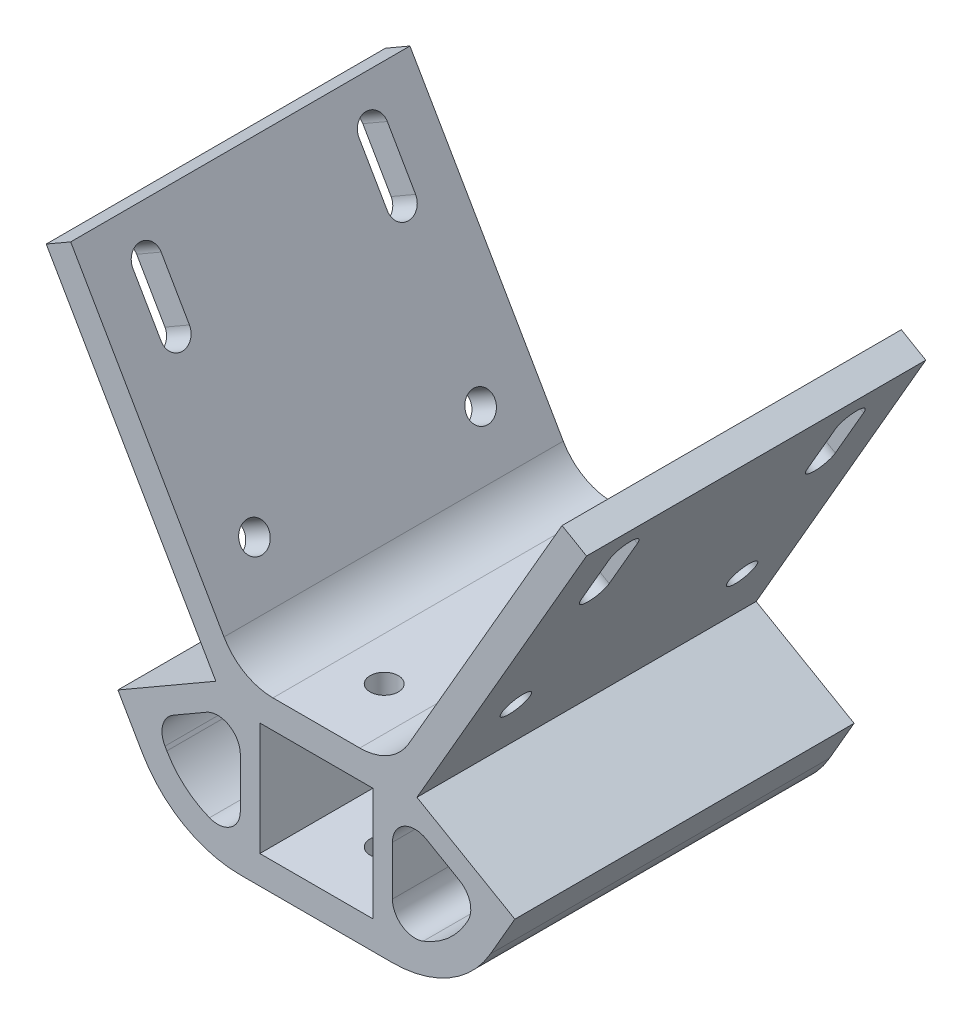
from build123d import *

# Parameters (mm, degrees)
SCHIZZO1_W                   = 20
SCHIZZO1_H                   = 20
ESTRUSIONE_ESTRUSIONE1_DEPTH = 60
RACCORDO1_R                  = 20
SCHIZZO8_R                   = 2.5
TAGLIO_ESTRUSIONE3_DEPTH     = 5
TAGLIO_ESTRUSIONE4_DEPTH     = 113.253811369
RACCORDO2_R                  = 10
RACCORDO3_R                  = 4
SCHIZZO11_R                  = 2.5
TAGLIO_ESTRUSIONE5_DEPTH     = 113.253811369


with BuildPart() as part:
    # Schizzo1 → Estrusione-Estrusione1 (new body)
    with BuildSketch(Plane.XY):
        Polygon((25, 0), (-25, 0), (-35.103629711, 17.5), (-17.783121635, 27.5), (-47.783121635, 79.461524227), (-43.452994616, 81.961524227), (-13.452994616, 30), (13.452994616, 30), (43.452994616, 81.961524227), (47.783121635, 79.461524227), (17.783121635, 27.5), (35.103629711, 17.5), align=None)
        with Locations((0, 15)):
            Rectangle(SCHIZZO1_W, SCHIZZO1_H, mode=Mode.SUBTRACT)
    extrude(amount=ESTRUSIONE_ESTRUSIONE1_DEPTH)

    # Raccordo1
    raccordo1_edges = [part.edges().sort_by_distance(p)[0] for p in [
        (25, 0, 30),
        (-25, 0, 30),
    ]]
    fillet(raccordo1_edges, radius=RACCORDO1_R)

    # Schizzo8 → Taglio-Estrusione3 (cut)
    with BuildSketch(Plane(origin=(-1.429491924, -0.825317547, 0), x_dir=(0, 0, 1), z_dir=(-0.8660254037844398, -0.49999999999999806, 0))):
        with Locations(Location((10, 47.707259422, 0), (0, 0, 270))):
            Circle(SCHIZZO8_R)
        with Locations(Location((50, 47.707259422, 0), (0, 0, 90))):
            Circle(SCHIZZO8_R)
        with BuildLine():
            Line((12.5, 85.707259422), (12.5, 75.707259422))
            ThreePointArc((12.5, 75.707259422), (10, 73.207259422), (7.5, 75.707259422))
            Line((7.5, 75.707259422), (7.5, 85.707259422))
            ThreePointArc((7.5, 85.707259422), (10, 88.207259422), (12.5, 85.707259422))
        make_face()
        with BuildLine():
            Line((47.5, 85.707259422), (47.5, 75.707259422))
            ThreePointArc((47.5, 75.707259422), (50, 73.207259422), (52.5, 75.707259422))
            Line((52.5, 75.707259422), (52.5, 85.707259422))
            ThreePointArc((52.5, 85.707259422), (50, 88.207259422), (47.5, 85.707259422))
        make_face()
    taglio_estrusione3 = extrude(amount=-TAGLIO_ESTRUSIONE3_DEPTH, mode=Mode.SUBTRACT)

    # Specchia1: Taglio-Estrusione3 across plane
    add(taglio_estrusione3.mirror(Plane(origin=(0, 0, 0), x_dir=(0, 0, 1), z_dir=(1, 0, 0))), mode=Mode.SUBTRACT)

    # Schizzo10 → Taglio-Estrusione4 (cut, through all)
    with BuildSketch(Plane(origin=(0, 0, 0), x_dir=(-1, 0, 0), z_dir=(0, 0, -1))):
        with BuildLine():
            Line((-28.773502692, 16.535898385), (-13.452994616, 25.381197846))
            Line((-13.452994616, 25.381197846), (-13.452994616, 5))
            ThreePointArc((-13.452994616, 5), (-20.952994616, 7.009618943), (-26.443375673, 12.5))
            Line((-26.443375673, 12.5), (-28.773502692, 16.535898385))
        make_face()
        with BuildLine():
            Line((13.452994616, 25.381197846), (13.452994616, 5))
            ThreePointArc((13.452994616, 5), (20.952994616, 7.009618943), (26.443375673, 12.5))
            Line((26.443375673, 12.5), (28.773502692, 16.535898385))
            Line((28.773502692, 16.535898385), (13.452994616, 25.381197846))
        make_face()
    extrude(amount=-TAGLIO_ESTRUSIONE4_DEPTH, mode=Mode.SUBTRACT)

    # Raccordo2
    raccordo2_edges = [part.edges().sort_by_distance(p)[0] for p in [
        (-13.452994616, 30, 30),
        (13.452994616, 30, 30),
    ]]
    fillet(raccordo2_edges, radius=RACCORDO2_R)

    # Raccordo3
    raccordo3_edges = [part.edges().sort_by_distance(p)[0] for p in [
        (28.773502692, 16.535898385, 30),
        (13.452994616, 25.381197846, 30),
        (13.452994616, 5, 30),
        (-13.452994616, 5, 30),
        (-13.452994616, 25.381197846, 30),
        (-28.773502692, 16.535898385, 30),
    ]]
    fillet(raccordo3_edges, radius=RACCORDO3_R)

    # Schizzo11 → Taglio-Estrusione5 (cut, through all)
    with BuildSketch(Plane.XZ):
        with Locations((0, 48)):
            Circle(SCHIZZO11_R)
        with Locations((0, 12)):
            Circle(SCHIZZO11_R)
    extrude(amount=-TAGLIO_ESTRUSIONE5_DEPTH, mode=Mode.SUBTRACT)


solid = part.part
